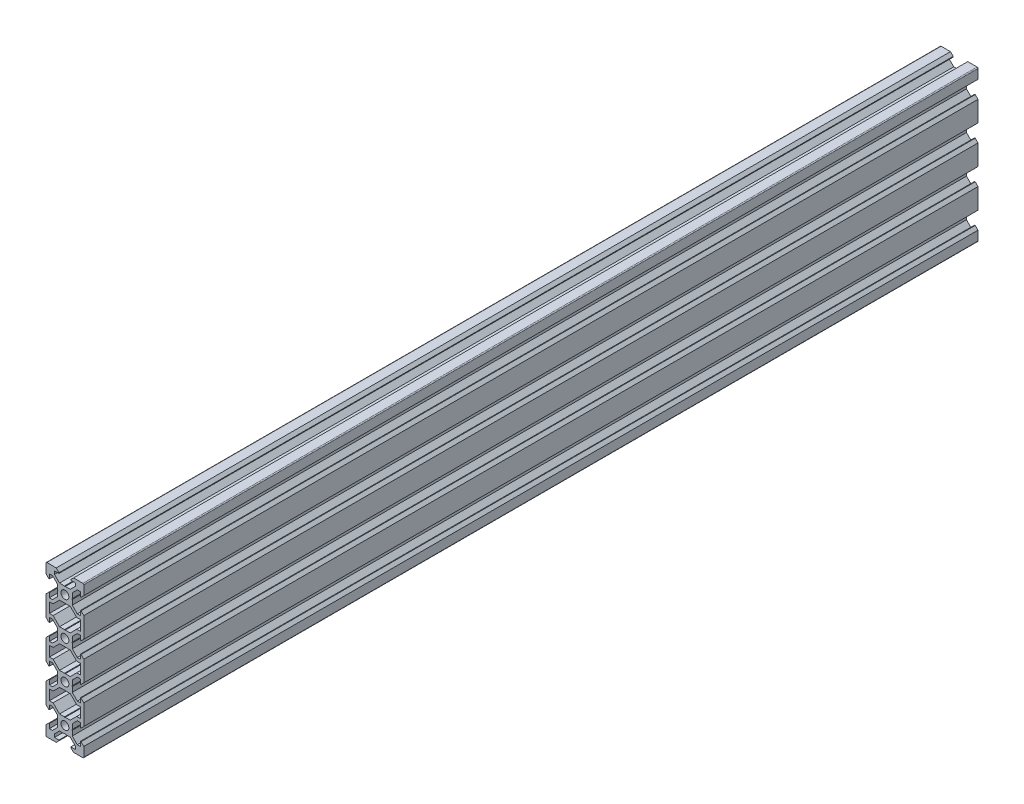
from build123d import *

# Parameters (mm, degrees)
BOSS_EXTRU_1_DEPTH = 473.43


with BuildPart() as part:
    # Esquisse1 → Boss.-Extru.1 (new body)
    with BuildSketch(Plane.XY):
        with BuildLine():
            Line((-9.5, 10), (-4.58, 10))
            Line((-4.58, 10), (-3.125, 8.545))
            Line((-3.125, 8.545), (-3.125, 8.2))
            Line((-3.125, 8.2), (-5.5, 8.2))
            Line((-5.5, 8.2), (-5.5, 6.560660172))
            Line((-5.5, 6.560660172), (-2.839339828, 3.9))
            Line((-2.839339828, 3.9), (-0.21, 3.9))
            Line((-0.21, 3.9), (0, 3.69))
            Line((0, 3.69), (0, 2.1))
            ThreePointArc((0, 2.1), (-2.1, 0), (0, -2.1))
            Line((0, -2.1), (0, -3.69))
            Line((0, -3.69), (-0.21, -3.9))
            Line((-0.21, -3.9), (-2.839339828, -3.9))
            Line((-2.839339828, -3.9), (-6.239339828, -7.3))
            Line((-6.239339828, -7.3), (-8.2, -7.3))
            Line((-8.2, -7.3), (-8.2, -12.7))
            Line((-8.2, -12.7), (-6.239339828, -12.7))
            Line((-6.239339828, -12.7), (-2.839339828, -16.1))
            Line((-2.839339828, -16.1), (-0.21, -16.1))
            Line((-0.21, -16.1), (0, -16.31))
            Line((0, -16.31), (0, -17.9))
            ThreePointArc((0, -17.9), (-2.1, -20), (0, -22.1))
            Line((0, -22.1), (0, -23.69))
            Line((0, -23.69), (-0.21, -23.9))
            Line((-0.21, -23.9), (-2.839339828, -23.9))
            Line((-2.839339828, -23.9), (-6.239339828, -27.3))
            Line((-6.239339828, -27.3), (-8.2, -27.3))
            Line((-8.2, -27.3), (-8.2, -32.7))
            Line((-8.2, -32.7), (-6.239339828, -32.7))
            Line((-6.239339828, -32.7), (-2.839339828, -36.1))
            Line((-2.839339828, -36.1), (-0.21, -36.1))
            Line((-0.21, -36.1), (0, -36.31))
            Line((0, -36.31), (0, -37.9))
            ThreePointArc((0, -37.9), (-2.1, -40), (0, -42.1))
            Line((0, -42.1), (0, -43.69))
            Line((0, -43.69), (-0.21, -43.9))
            Line((-0.21, -43.9), (-2.839339828, -43.9))
            Line((-2.839339828, -43.9), (-6.239339828, -47.3))
            Line((-6.239339828, -47.3), (-8.2, -47.3))
            Line((-8.2, -47.3), (-8.2, -52.7))
            Line((-8.2, -52.7), (-6.239339828, -52.7))
            Line((-6.239339828, -52.7), (-2.839339828, -56.1))
            Line((-2.839339828, -56.1), (-0.21, -56.1))
            Line((-0.21, -56.1), (0, -56.31))
            Line((0, -56.31), (0, -57.9))
            ThreePointArc((0, -57.9), (-2.1, -60), (0, -62.1))
            Line((0, -62.1), (0, -63.69))
            Line((0, -63.69), (-0.21, -63.9))
            Line((-0.21, -63.9), (-2.839339828, -63.9))
            Line((-2.839339828, -63.9), (-5.5, -66.560660172))
            Line((-5.5, -66.560660172), (-5.5, -68.2))
            Line((-5.5, -68.2), (-3.125, -68.2))
            Line((-3.125, -68.2), (-3.125, -68.545))
            Line((-3.125, -68.545), (-4.58, -70))
            Line((-4.58, -70), (-9.5, -70))
            ThreePointArc((-9.5, -70), (-9.853553391, -69.853553391), (-10, -69.5))
            Line((-10, -69.5), (-10, -64.58))
            Line((-10, -64.58), (-8.545, -63.125))
            Line((-8.545, -63.125), (-8.2, -63.125))
            Line((-8.2, -63.125), (-8.2, -65.5))
            Line((-8.2, -65.5), (-6.560660172, -65.5))
            Line((-6.560660172, -65.5), (-3.9, -62.839339828))
            Line((-3.9, -62.839339828), (-3.9, -60.21))
            Line((-3.9, -60.21), (-3.69, -60))
            Line((-3.69, -60), (-3.9, -59.79))
            Line((-3.9, -59.79), (-3.9, -57.160660172))
            Line((-3.9, -57.160660172), (-6.560660172, -54.5))
            Line((-6.560660172, -54.5), (-8.2, -54.5))
            Line((-8.2, -54.5), (-8.2, -56.875))
            Line((-8.2, -56.875), (-8.545, -56.875))
            Line((-8.545, -56.875), (-10, -55.42))
            Line((-10, -55.42), (-10, -44.58))
            Line((-10, -44.58), (-8.545, -43.125))
            Line((-8.545, -43.125), (-8.2, -43.125))
            Line((-8.2, -43.125), (-8.2, -45.5))
            Line((-8.2, -45.5), (-6.560660172, -45.5))
            Line((-6.560660172, -45.5), (-3.9, -42.839339828))
            Line((-3.9, -42.839339828), (-3.9, -40.21))
            Line((-3.9, -40.21), (-3.69, -40))
            Line((-3.69, -40), (-3.9, -39.79))
            Line((-3.9, -39.79), (-3.9, -37.160660172))
            Line((-3.9, -37.160660172), (-6.560660172, -34.5))
            Line((-6.560660172, -34.5), (-8.2, -34.5))
            Line((-8.2, -34.5), (-8.2, -36.875))
            Line((-8.2, -36.875), (-8.545, -36.875))
            Line((-8.545, -36.875), (-10, -35.42))
            Line((-10, -35.42), (-10, -24.58))
            Line((-10, -24.58), (-8.545, -23.125))
            Line((-8.545, -23.125), (-8.2, -23.125))
            Line((-8.2, -23.125), (-8.2, -25.5))
            Line((-8.2, -25.5), (-6.560660172, -25.5))
            Line((-6.560660172, -25.5), (-3.9, -22.839339828))
            Line((-3.9, -22.839339828), (-3.9, -20.21))
            Line((-3.9, -20.21), (-3.69, -20))
            Line((-3.69, -20), (-3.9, -19.79))
            Line((-3.9, -19.79), (-3.9, -17.160660172))
            Line((-3.9, -17.160660172), (-6.560660172, -14.5))
            Line((-6.560660172, -14.5), (-8.2, -14.5))
            Line((-8.2, -14.5), (-8.2, -16.875))
            Line((-8.2, -16.875), (-8.545, -16.875))
            Line((-8.545, -16.875), (-10, -15.42))
            Line((-10, -15.42), (-10, -4.58))
            Line((-10, -4.58), (-8.545, -3.125))
            Line((-8.545, -3.125), (-8.2, -3.125))
            Line((-8.2, -3.125), (-8.2, -5.5))
            Line((-8.2, -5.5), (-6.560660172, -5.5))
            Line((-6.560660172, -5.5), (-3.9, -2.839339828))
            Line((-3.9, -2.839339828), (-3.9, -0.21))
            Line((-3.9, -0.21), (-3.69, 0))
            Line((-3.69, 0), (-3.9, 0.21))
            Line((-3.9, 0.21), (-3.9, 2.839339828))
            Line((-3.9, 2.839339828), (-6.560660172, 5.5))
            Line((-6.560660172, 5.5), (-8.2, 5.5))
            Line((-8.2, 5.5), (-8.2, 3.125))
            Line((-8.2, 3.125), (-8.545, 3.125))
            Line((-8.545, 3.125), (-10, 4.58))
            Line((-10, 4.58), (-10, 9.5))
            ThreePointArc((-10, 9.5), (-9.853553391, 9.853553391), (-9.5, 10))
        make_face()
    boss_extru_1 = extrude(amount=BOSS_EXTRU_1_DEPTH)

    # Symétrie1: Boss.-Extru.1 across plane
    add(boss_extru_1.mirror(Plane(origin=(0, 3.69, 473.43), x_dir=(0, 0, 1), z_dir=(-1, 0, 0))))


solid = part.part
